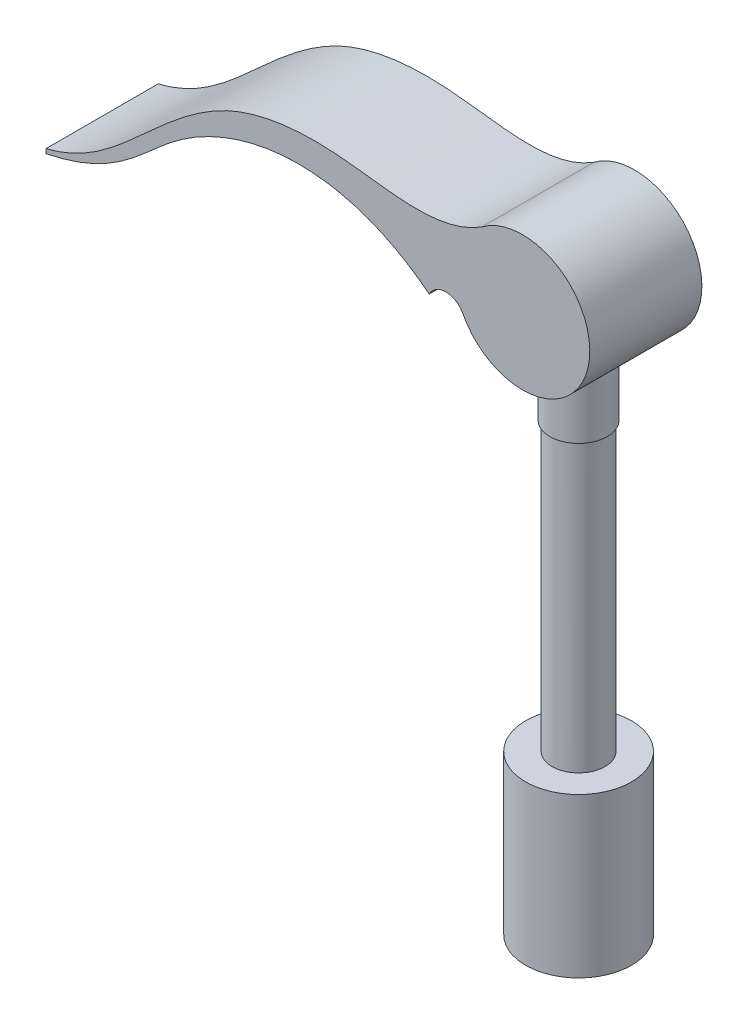
from build123d import *

# Parameters (mm, degrees)
SKETCH1_R                = 3
BOSS_EXTRUDE1_DEPTH      = 32.5
BOSS_EXTRUDE2_DEPTH      = 6.35
BOSS_EXTRUDE3_REACH      = 87.109
BOSS_EXTRUDE3_END_RADIUS = 7.62
BOSS_EXTRUDE3_START      = 18
SKETCH3_R                = 3.25
SKETCH4_R                = 6
BOSS_EXTRUDE4_DEPTH      = 18


with BuildPart() as part:
    # Sketch1 → Boss-Extrude1 (new, symmetric)
    with BuildSketch(Plane(origin=(0, 0, 0), x_dir=(1, 0, 0), z_dir=(0, 1, 0))):
        with Locations(Location((0, 0, 0), (0, 0, 270))):
            Circle(SKETCH1_R)
    extrude(amount=BOSS_EXTRUDE1_DEPTH, both=True)

    # Sketch2 → Boss-Extrude2 (add, symmetric)
    with BuildSketch(Plane.XY):
        with BuildLine():
            Line((-53.975, 20.32), (-53.975, 20.828))
            add(Edge.make_bspline(
                [(-53.975, 20.828), (-48.579084473, 22.104261863), (-42.739180184, 28.451304863), (-32.707581635, 36.217235943), (-19.445903171, 37.601432098), (-9.805142387, 34.528428283), (-4.615884318, 37.812838606)],
                knots=[0, 0, 0, 0, 0.290913355, 0.472280192, 0.684923774, 1, 1, 1, 1], degree=3))
            ThreePointArc((-4.615884318, 37.812838606), (7.434387163, 30.07838775), (-6.766850807, 28.24655453))
            ThreePointArc((-6.766850807, 28.24655453), (-8.671850807, 29.405444626), (-10.576850807, 28.24655453))
            add(Edge.make_bspline(
                [(-53.975, 20.32), (-46.121670197, 21.895048491), (-37.272795223, 34.142014089), (-20.262703733, 35.94817115), (-10.576850807, 28.24655453)],
                knots=[0, 0, 0, 0, 0.320306102, 1, 1, 1, 1], degree=3))
        make_face()
    extrude(amount=BOSS_EXTRUDE2_DEPTH, both=True)

    # Boss-Extrude3: up to this cylinder (the profile starts outside it)
    boss_extrude3_end = Plane(origin=(0, 31.75, 0), z_dir=(0, 0, -1)) * Cylinder(BOSS_EXTRUDE3_END_RADIUS, 190.458, mode=Mode.PRIVATE)
    # Sketch3 → Boss-Extrude3 (add, up to the surface)
    with BuildSketch(Plane(origin=(0, 0, 0), x_dir=(1, 0, 0), z_dir=(0, 1, 0)).offset(BOSS_EXTRUDE3_START), mode=Mode.PRIVATE) as boss_extrude3_sk1:
        with Locations(Location((0, 0, 0), (0, 0, 90))):
            Circle(SKETCH3_R)
    boss_extrude3_tool1 = extrude(boss_extrude3_sk1.sketch, amount=BOSS_EXTRUDE3_REACH, mode=Mode.PRIVATE) - boss_extrude3_end
    add(boss_extrude3_tool1.solids().sort_by_distance((0, 18, 0))[0])

    # Sketch4 → Boss-Extrude4 (add)
    with BuildSketch(Plane.XZ.offset(32.5)):
        with Locations(Location((0, 0, 0), (0, 0, 270))):
            Circle(SKETCH4_R)
    extrude(amount=-BOSS_EXTRUDE4_DEPTH)


solid = part.part
